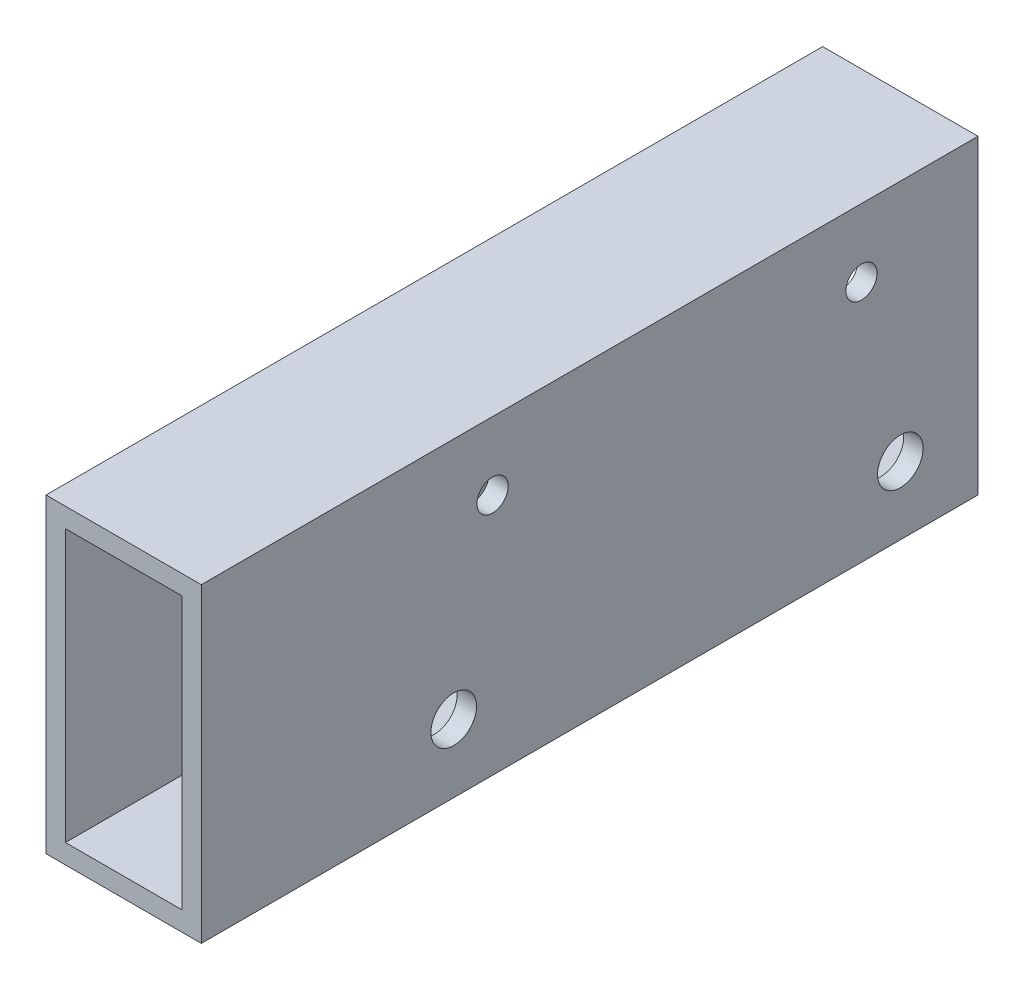
from build123d import *

# Parameters (mm, degrees)
SKETCH1_W           = 25.4
SKETCH1_H           = 50.8
SKETCH1_W_2         = 19.05
SKETCH1_H_2         = 44.45
BOSS_EXTRUDE1_DEPTH = 63.5
SKETCH3_R           = 3.72872
SKETCH3_R_2         = 2.5527
CUT_EXTRUDE1_DEPTH  = 73.955945611


with BuildPart() as part:
    # Sketch1 → Boss-Extrude1 (new, symmetric)
    with BuildSketch(Plane.XY):
        Rectangle(SKETCH1_W, SKETCH1_H)
        Rectangle(SKETCH1_W_2, SKETCH1_H_2, mode=Mode.SUBTRACT)
    extrude(amount=BOSS_EXTRUDE1_DEPTH, both=True)

    # Sketch3 → Cut-Extrude1 (cut, through all)
    with BuildSketch(Plane(origin=(12.7, 0, 0), x_dir=(0, 0, -1), z_dir=(1, 0, 0))):
        with Locations(Location((50.8, -14.2875, 0), (0, 0, 90))):
            Circle(SKETCH3_R)
        with Locations(Location((-22.225, -14.2875, 0), (0, 0, 90))):
            Circle(SKETCH3_R)
        with Locations(Location((44.45, 14.2875, 0), (0, 0, 90))):
            Circle(SKETCH3_R_2)
        with Locations(Location((-15.875, 14.2875, 0), (0, 0, 90))):
            Circle(SKETCH3_R_2)
    extrude(amount=-CUT_EXTRUDE1_DEPTH, mode=Mode.SUBTRACT)


solid = part.part
